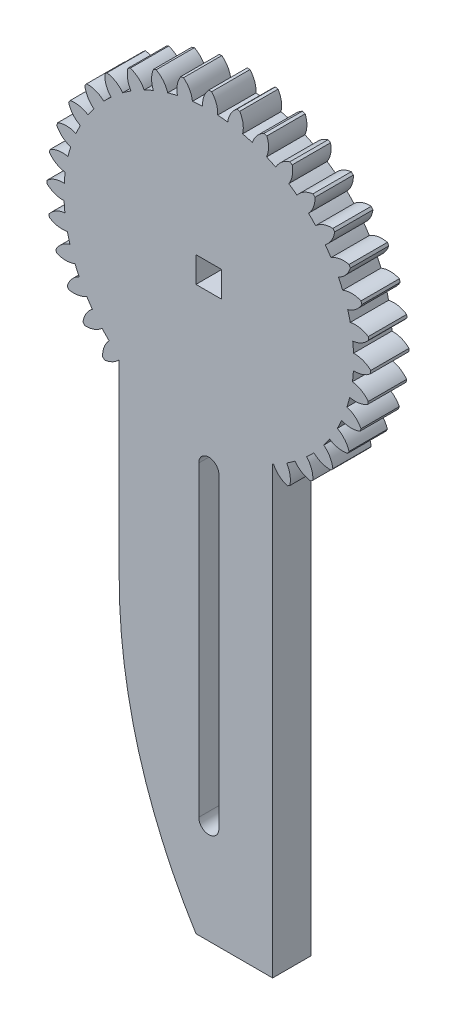
from build123d import *

# Parameters (mm, degrees)
SKETCH3_W           = 3.2
SKETCH3_H           = 3.2
BOSS_EXTRUDE2_DEPTH = 4.7625
CUT_EXTRUDE1_DEPTH  = 10.16


with BuildPart() as part:
    # Sketch3 → Boss-Extrude2 (new body)
    # profile 1 of 2: a face of its own
    with BuildSketch(Plane.XY):
        with BuildLine():
            Line((-1.6002, -71.4248), (7.9248, -71.4248))
            Line((7.9248, -71.4248), (7.9248, -12.7))
            Line((7.9248, -12.7), (-11.1252, -12.7))
            Line((-11.1252, -12.7), (-11.1252, -38.1))
            ThreePointArc((-11.1252, -38.1), (-8.697206621, -55.429656085), (-1.6002, -71.4248))
        make_face()
    # profile 2 of 2: a face of its own
    with BuildSketch(Plane.XY):
        with BuildLine():
            ThreePointArc((-17.153553076, 5.408494509), (-17.331857331, 4.806549432), (-17.489045388, 4.198748315))
            ThreePointArc((-17.489045388, 4.198748315), (-18.648249047, 4.242523406), (-19.734731059, 3.836043123))
            ThreePointArc((-19.734731059, 3.836043123), (-19.767454987, 3.663681227), (-19.798673548, 3.491040328))
            ThreePointArc((-19.798673548, 3.491040328), (-18.930024713, 2.722197962), (-17.832127277, 2.347644092))
            ThreePointArc((-17.832127277, 2.347644092), (-17.903196024, 1.723881704), (-17.952452485, 1.098019031))
            ThreePointArc((-17.952452485, 1.098019031), (-19.1016467, 0.939835478), (-20.101038048, 0.350864924))
            ThreePointArc((-20.101038048, 0.350864924), (-20.103334497, 0.175439142), (-20.1041, 0))
            ThreePointArc((-20.1041, 0), (-19.115139817, -0.606322635), (-17.968881314, -0.784538301))
            ThreePointArc((-17.968881314, -0.784538301), (-17.930555165, -1.411165297), (-17.870383396, -2.036073004))
            ThreePointArc((-17.870383396, -2.036073004), (-18.974650483, -2.391408875), (-19.856585168, -3.144974129))
            ThreePointArc((-19.856585168, -3.144974129), (-19.828384362, -3.318133573), (-19.798673547, -3.491040329))
            ThreePointArc((-19.798673547, -3.491040329), (-18.719451071, -3.916420428), (-17.559659984, -3.892882897))
            ThreePointArc((-17.559659984, -3.892882897), (-17.41310346, -4.503334753), (-17.245331751, -5.10829999))
            ThreePointArc((-17.245331751, -5.10829999), (-18.271119114, -5.649991478), (-19.008799995, -6.545254734))
            ThreePointArc((-19.008799995, -6.545254734), (-18.950958801, -6.710886479), (-18.891674417, -6.876007163))
            ThreePointArc((-18.891674417, -6.876007163), (-17.754981276, -7.107519766), (-16.616897271, -6.882944214))
            ThreePointArc((-16.616897271, -6.882944214), (-16.366563418, -7.458672662), (-16.096289427, -8.025313866))
            ThreePointArc((-16.096289427, -8.025313866), (-17.012429035, -8.73690195), (-17.583442053, -9.746661087))
            ThreePointArc((-17.583442053, -9.746661087), (-17.497717946, -9.899732495), (-17.410661319, -10.052050001))
            ThreePointArc((-17.410661319, -10.052050001), (-16.25103536, -10.082660714), (-15.169238544, -9.663870756))
            ThreePointArc((-15.169238544, -9.663870756), (-14.822733628, -10.187382578), (-14.458169495, -10.698482643))
            ThreePointArc((-14.458169495, -10.698482643), (-15.236824909, -11.558346078), (-15.623820123, -12.651920074))
            ThreePointArc((-15.623820123, -12.651920074), (-15.512817786, -12.787780149), (-15.400634088, -12.922666385))
            ThreePointArc((-15.400634088, -12.922666385), (-14.253309958, -12.751445119), (-13.260670179, -12.151165475))
            ThreePointArc((-13.260670179, -12.151165475), (-12.828522578, -12.606554028), (-12.380745398, -13.046583437))
            ThreePointArc((-12.380745398, -13.046583437), (-12.998257569, -14.028595708), (-13.189476325, -15.172756872))
            ThreePointArc((-13.189476325, -15.172756872), (-13.056568509, -15.287277573), (-12.922666384, -15.400634089))
            ThreePointArc((-12.922666384, -15.400634089), (-11.822504947, -15.032783314), (-10.949183062, -14.269253178))
            ThreePointArc((-10.949183062, -14.269253178), (-10.444523361, -14.642681713), (-9.927138617, -14.998270395))
            ThreePointArc((-9.927138617, -14.998270395), (-10.36474475, -16.072593557), (-10.354376961, -17.232577131))
            ThreePointArc((-10.354376961, -17.232577131), (-10.203602002, -17.322278805), (-10.052049999, -17.410661321))
            ThreePointArc((-10.052049999, -17.410661321), (-9.032479103, -16.857357997), (-8.305010557, -15.953776846))
            ThreePointArc((-8.305010557, -15.953776846), (-7.743172587, -16.233898925), (-7.171900753, -16.494242498))
            ThreePointArc((-7.171900753, -16.494242498), (-7.416304405, -17.628233784), (-7.204665094, -18.768794252))
            ThreePointArc((-7.204665094, -18.768794252), (-7.040604212, -18.83095136), (-6.876007162, -18.891674418))
            ThreePointArc((-6.876007162, -18.891674418), (-5.968005952, -18.169730386), (-5.408494509, -17.153553076))
            ThreePointArc((-5.408494509, -17.153553076), (-4.806549432, -17.331857331), (-4.198748315, -17.489045388))
            ThreePointArc((-4.198748315, -17.489045388), (-4.242523406, -18.648249047), (-3.836043123, -19.734731059))
            ThreePointArc((-3.836043123, -19.734731059), (-3.663681227, -19.767454987), (-3.491040328, -19.798673548))
            ThreePointArc((-3.491040328, -19.798673548), (-2.722197962, -18.930024713), (-2.347644092, -17.832127277))
            ThreePointArc((-2.347644092, -17.832127277), (-1.723881704, -17.903196024), (-1.098019031, -17.952452485))
            ThreePointArc((-1.098019031, -17.952452485), (-0.939835478, -19.1016467), (-0.350864924, -20.101038048))
            ThreePointArc((-0.350864924, -20.101038048), (-0.175439142, -20.103334497), (0, -20.1041))
            ThreePointArc((0, -20.1041), (0.606322635, -19.115139817), (0.784538301, -17.968881314))
            ThreePointArc((0.784538301, -17.968881314), (1.411165297, -17.930555165), (2.036073004, -17.870383396))
            ThreePointArc((2.036073004, -17.870383396), (2.391408875, -18.974650483), (3.144974129, -19.856585168))
            ThreePointArc((3.144974129, -19.856585168), (3.318133573, -19.828384362), (3.491040329, -19.798673547))
            ThreePointArc((3.491040329, -19.798673547), (3.916420428, -18.719451071), (3.892882897, -17.559659984))
            ThreePointArc((3.892882897, -17.559659984), (4.503334753, -17.41310346), (5.10829999, -17.245331751))
            ThreePointArc((5.10829999, -17.245331751), (5.649991478, -18.271119114), (6.545254734, -19.008799995))
            ThreePointArc((6.545254734, -19.008799995), (6.710886479, -18.950958801), (6.876007163, -18.891674417))
            ThreePointArc((6.876007163, -18.891674417), (7.107519766, -17.754981276), (6.882944214, -16.616897271))
            ThreePointArc((6.882944214, -16.616897271), (7.458672662, -16.366563418), (8.025313866, -16.096289427))
            ThreePointArc((8.025313866, -16.096289427), (8.73690195, -17.012429035), (9.746661087, -17.583442053))
            ThreePointArc((9.746661087, -17.583442053), (9.899732495, -17.497717946), (10.052050001, -17.410661319))
            ThreePointArc((10.052050001, -17.410661319), (10.082660714, -16.25103536), (9.663870756, -15.169238544))
            ThreePointArc((9.663870756, -15.169238544), (10.187382578, -14.822733628), (10.698482643, -14.458169495))
            ThreePointArc((10.698482643, -14.458169495), (11.558346078, -15.236824909), (12.651920074, -15.623820123))
            ThreePointArc((12.651920074, -15.623820123), (12.787780149, -15.512817786), (12.922666385, -15.400634088))
            ThreePointArc((12.922666385, -15.400634088), (12.751445119, -14.253309958), (12.151165475, -13.260670179))
            ThreePointArc((12.151165475, -13.260670179), (12.606554028, -12.828522578), (13.046583437, -12.380745398))
            ThreePointArc((13.046583437, -12.380745398), (14.028595708, -12.998257569), (15.172756872, -13.189476325))
            ThreePointArc((15.172756872, -13.189476325), (15.287277573, -13.056568509), (15.400634089, -12.922666384))
            ThreePointArc((15.400634089, -12.922666384), (15.032783314, -11.822504947), (14.269253178, -10.949183062))
            ThreePointArc((14.269253178, -10.949183062), (14.642681713, -10.444523361), (14.998270395, -9.927138617))
            ThreePointArc((14.998270395, -9.927138617), (16.072593557, -10.36474475), (17.232577131, -10.354376961))
            ThreePointArc((17.232577131, -10.354376961), (17.322278805, -10.203602002), (17.410661321, -10.052049999))
            ThreePointArc((17.410661321, -10.052049999), (16.857357997, -9.032479103), (15.953776846, -8.305010557))
            ThreePointArc((15.953776846, -8.305010557), (16.233898925, -7.743172587), (16.494242498, -7.171900753))
            ThreePointArc((16.494242498, -7.171900753), (17.628233784, -7.416304405), (18.768794252, -7.204665094))
            ThreePointArc((18.768794252, -7.204665094), (18.83095136, -7.040604212), (18.891674418, -6.876007162))
            ThreePointArc((18.891674418, -6.876007162), (18.169730386, -5.968005952), (17.153553076, -5.408494509))
            ThreePointArc((17.153553076, -5.408494509), (17.331857331, -4.806549432), (17.489045388, -4.198748315))
            ThreePointArc((17.489045388, -4.198748315), (18.648249047, -4.242523406), (19.734731059, -3.836043123))
            ThreePointArc((19.734731059, -3.836043123), (19.767454987, -3.663681227), (19.798673548, -3.491040328))
            ThreePointArc((19.798673548, -3.491040328), (18.930024713, -2.722197962), (17.832127277, -2.347644092))
            ThreePointArc((17.832127277, -2.347644092), (17.903196024, -1.723881704), (17.952452485, -1.098019031))
            ThreePointArc((17.952452485, -1.098019031), (19.1016467, -0.939835478), (20.101038048, -0.350864924))
            ThreePointArc((20.101038048, -0.350864924), (20.103334497, -0.175439142), (20.1041, 0))
            ThreePointArc((20.1041, 0), (19.115139817, 0.606322635), (17.968881314, 0.784538301))
            ThreePointArc((17.968881314, 0.784538301), (17.930555165, 1.411165297), (17.870383396, 2.036073004))
            ThreePointArc((17.870383396, 2.036073004), (18.974650483, 2.391408875), (19.856585168, 3.144974129))
            ThreePointArc((19.856585168, 3.144974129), (19.828384362, 3.318133573), (19.798673547, 3.491040329))
            ThreePointArc((19.798673547, 3.491040329), (18.719451071, 3.916420428), (17.559659984, 3.892882897))
            ThreePointArc((17.559659984, 3.892882897), (17.41310346, 4.503334753), (17.245331751, 5.10829999))
            ThreePointArc((17.245331751, 5.10829999), (18.271119114, 5.649991478), (19.008799995, 6.545254734))
            ThreePointArc((19.008799995, 6.545254734), (18.950958801, 6.710886479), (18.891674417, 6.876007163))
            ThreePointArc((18.891674417, 6.876007163), (17.754981276, 7.107519766), (16.616897271, 6.882944214))
            ThreePointArc((16.616897271, 6.882944214), (16.366563418, 7.458672662), (16.096289427, 8.025313866))
            ThreePointArc((16.096289427, 8.025313866), (17.012429035, 8.73690195), (17.583442053, 9.746661087))
            ThreePointArc((17.583442053, 9.746661087), (17.497717946, 9.899732495), (17.410661319, 10.052050001))
            ThreePointArc((17.410661319, 10.052050001), (16.25103536, 10.082660714), (15.169238544, 9.663870756))
            ThreePointArc((15.169238544, 9.663870756), (14.822733628, 10.187382578), (14.458169495, 10.698482643))
            ThreePointArc((14.458169495, 10.698482643), (15.236824909, 11.558346078), (15.623820123, 12.651920074))
            ThreePointArc((15.623820123, 12.651920074), (15.512817786, 12.787780149), (15.400634088, 12.922666385))
            ThreePointArc((15.400634088, 12.922666385), (14.253309958, 12.751445119), (13.260670179, 12.151165475))
            ThreePointArc((13.260670179, 12.151165475), (12.828522578, 12.606554028), (12.380745398, 13.046583437))
            ThreePointArc((12.380745398, 13.046583437), (12.998257569, 14.028595708), (13.189476325, 15.172756872))
            ThreePointArc((13.189476325, 15.172756872), (13.056568509, 15.287277573), (12.922666384, 15.400634089))
            ThreePointArc((12.922666384, 15.400634089), (11.822504947, 15.032783314), (10.949183062, 14.269253178))
            ThreePointArc((10.949183062, 14.269253178), (10.444523361, 14.642681713), (9.927138617, 14.998270395))
            ThreePointArc((9.927138617, 14.998270395), (10.36474475, 16.072593557), (10.354376961, 17.232577131))
            ThreePointArc((10.354376961, 17.232577131), (10.203602002, 17.322278805), (10.052049999, 17.410661321))
            ThreePointArc((10.052049999, 17.410661321), (9.032479103, 16.857357997), (8.305010557, 15.953776846))
            ThreePointArc((8.305010557, 15.953776846), (7.743172587, 16.233898925), (7.171900753, 16.494242498))
            ThreePointArc((7.171900753, 16.494242498), (7.416304405, 17.628233784), (7.204665094, 18.768794252))
            ThreePointArc((7.204665094, 18.768794252), (7.040604212, 18.83095136), (6.876007162, 18.891674418))
            ThreePointArc((6.876007162, 18.891674418), (5.968005952, 18.169730386), (5.408494509, 17.153553076))
            ThreePointArc((5.408494509, 17.153553076), (4.806549432, 17.331857331), (4.198748315, 17.489045388))
            ThreePointArc((4.198748315, 17.489045388), (4.242523406, 18.648249047), (3.836043123, 19.734731059))
            ThreePointArc((3.836043123, 19.734731059), (3.663681227, 19.767454987), (3.491040328, 19.798673548))
            ThreePointArc((3.491040328, 19.798673548), (2.722197962, 18.930024713), (2.347644092, 17.832127277))
            ThreePointArc((2.347644092, 17.832127277), (1.723881704, 17.903196024), (1.098019031, 17.952452485))
            ThreePointArc((1.098019031, 17.952452485), (0.939835478, 19.1016467), (0.350864924, 20.101038048))
            ThreePointArc((0.350864924, 20.101038048), (0.175439142, 20.103334497), (0, 20.1041))
            ThreePointArc((0, 20.1041), (-0.606322635, 19.115139817), (-0.784538301, 17.968881314))
            ThreePointArc((-0.784538301, 17.968881314), (-1.411165297, 17.930555165), (-2.036073004, 17.870383396))
            ThreePointArc((-2.036073004, 17.870383396), (-2.391408875, 18.974650483), (-3.144974129, 19.856585168))
            ThreePointArc((-3.144974129, 19.856585168), (-3.318133573, 19.828384362), (-3.491040329, 19.798673547))
            ThreePointArc((-3.491040329, 19.798673547), (-3.916420428, 18.719451071), (-3.892882897, 17.559659984))
            ThreePointArc((-3.892882897, 17.559659984), (-4.503334753, 17.41310346), (-5.10829999, 17.245331751))
            ThreePointArc((-5.10829999, 17.245331751), (-5.649991478, 18.271119114), (-6.545254734, 19.008799995))
            ThreePointArc((-6.545254734, 19.008799995), (-6.710886479, 18.950958801), (-6.876007163, 18.891674417))
            ThreePointArc((-6.876007163, 18.891674417), (-7.107519766, 17.754981276), (-6.882944214, 16.616897271))
            ThreePointArc((-6.882944214, 16.616897271), (-7.458672662, 16.366563418), (-8.025313866, 16.096289427))
            ThreePointArc((-8.025313866, 16.096289427), (-8.73690195, 17.012429035), (-9.746661087, 17.583442053))
            ThreePointArc((-9.746661087, 17.583442053), (-9.899732495, 17.497717946), (-10.052050001, 17.410661319))
            ThreePointArc((-10.052050001, 17.410661319), (-10.082660714, 16.25103536), (-9.663870756, 15.169238544))
            ThreePointArc((-9.663870756, 15.169238544), (-10.187382578, 14.822733628), (-10.698482643, 14.458169495))
            ThreePointArc((-10.698482643, 14.458169495), (-11.558346078, 15.236824909), (-12.651920074, 15.623820123))
            ThreePointArc((-12.651920074, 15.623820123), (-12.787780149, 15.512817786), (-12.922666385, 15.400634088))
            ThreePointArc((-12.922666385, 15.400634088), (-12.751445119, 14.253309958), (-12.151165475, 13.260670179))
            ThreePointArc((-12.151165475, 13.260670179), (-12.606554028, 12.828522578), (-13.046583437, 12.380745398))
            ThreePointArc((-13.046583437, 12.380745398), (-14.028595708, 12.998257569), (-15.172756872, 13.189476325))
            ThreePointArc((-15.172756872, 13.189476325), (-15.287277573, 13.056568509), (-15.400634089, 12.922666384))
            ThreePointArc((-15.400634089, 12.922666384), (-15.032783314, 11.822504947), (-14.269253178, 10.949183062))
            ThreePointArc((-14.269253178, 10.949183062), (-14.642681713, 10.444523361), (-14.998270396, 9.927138618))
            ThreePointArc((-14.998270396, 9.927138618), (-16.072593557, 10.36474475), (-17.232577131, 10.354376961))
            ThreePointArc((-17.232577131, 10.354376961), (-17.322278805, 10.203602002), (-17.410661321, 10.052049999))
            ThreePointArc((-17.410661321, 10.052049999), (-16.857357997, 9.032479103), (-15.953776846, 8.305010557))
            ThreePointArc((-15.953776846, 8.305010557), (-16.233898925, 7.743172587), (-16.494242498, 7.171900753))
            ThreePointArc((-16.494242498, 7.171900753), (-17.628233784, 7.416304405), (-18.768794252, 7.204665094))
            ThreePointArc((-18.768794252, 7.204665094), (-18.83095136, 7.040604212), (-18.891674418, 6.876007162))
            ThreePointArc((-18.891674418, 6.876007162), (-18.169730386, 5.968005952), (-17.153553076, 5.408494509))
        make_face()
        Rectangle(SKETCH3_W, SKETCH3_H, mode=Mode.SUBTRACT)
    extrude(amount=BOSS_EXTRUDE2_DEPTH)

    # Sketch5 → Cut-Extrude1 (cut)
    with BuildSketch(Plane.XY.offset(4.7625)):
        with BuildLine():
            Line((-1.25, -58.7248), (-1.25, -20.6248))
            ThreePointArc((-1.25, -20.6248), (0, -19.3748), (1.25, -20.6248))
            Line((1.25, -20.6248), (1.25, -58.7248))
            ThreePointArc((1.25, -58.7248), (0, -59.9748), (-1.25, -58.7248))
        make_face()
    extrude(amount=-CUT_EXTRUDE1_DEPTH, mode=Mode.SUBTRACT)


solid = part.part
